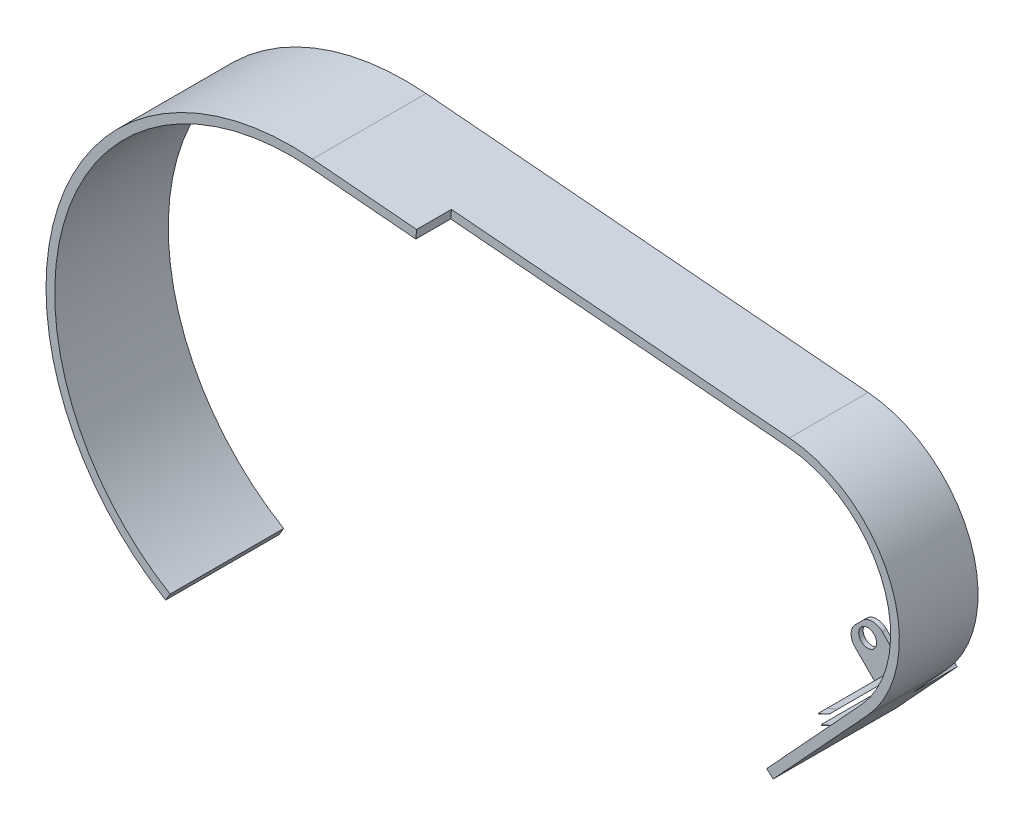
from build123d import *

# Parameters (mm, degrees)
BOSS_EXTRUDE1_DEPTH   = 25.4
BOSS_EXTRUDE1_2_DEPTH = 25.4
SKETCH2_R             = 7.0739
SKETCH2_R_2           = 3.2639
BOSS_EXTRUDE2_DEPTH   = 3.175
BOSS_EXTRUDE3_DEPTH   = 3.302
BOSS_EXTRUDE4_DEPTH   = 12.7
BOSS_EXTRUDE5_DEPTH   = 16.1925
SKETCH6_R             = 3.2639
BOSS_EXTRUDE6_DEPTH   = 1.5875


with BuildPart() as part:
    # Sketch1 → Boss-Extrude1 (new body)
    with BuildSketch(Plane.XY):
        with BuildLine():
            ThreePointArc((70.001721328, 21.116929737), (32.109818913, 121.760822938), (121.667937999, 181.295122405))
            Line((121.667937999, 181.295122405), (282.867264941, 167.491822308))
            ThreePointArc((282.867264941, 167.491822308), (317.285019746, 141.708326855), (309.281467912, 99.455354869))
            Line((309.281467912, 99.455354869), (298.182872237, 87.415180491))
            ThreePointArc((298.182872237, 87.415180491), (296.481974793, 86.652009193), (294.750152503, 85.961883046))
            Line((294.750152503, 85.961883046), (294.839214659, 85.723778364))
            Line((294.839214659, 85.723778364), (298.161838441, 87.392362238))
            Line((298.161838441, 87.392362238), (274.850661498, 62.103519979))
            Line((274.850661498, 62.103519979), (277.185151179, 59.951594578))
            Line((277.185151179, 59.951594578), (311.615957593, 97.303429468))
            ThreePointArc((311.615957593, 97.303429468), (320.244786914, 142.85741489), (283.138145015, 170.655245926))
            Line((283.138145015, 170.655245926), (121.938818073, 184.458546023))
            ThreePointArc((121.938818073, 184.458546023), (29.088121079, 122.735485546), (68.373108141, 18.391449213))
            Line((68.373108141, 18.391449213), (70.001721328, 21.116929737))
        make_face()
    extrude(amount=BOSS_EXTRUDE1_DEPTH)

    # Sketch2 → Boss-Extrude2 (add)
    # profile 1 of 2: a face of its own
    with BuildSketch(Plane(origin=(0, 0, 0), x_dir=(-1, 0, 0), z_dir=(0, 0, -1))):
        with BuildLine():
            ThreePointArc((-36.587701927, 50.782990283), (-44.384911147, 39.317928918), (-53.858754358, 29.194174745))
            Line((-53.858754358, 29.194174745), (-22.316186857, 12.775282108))
            ThreePointArc((-22.316186857, 12.775282108), (-23.932636358, 13.931413925), (-25.163710326, 15.491544259))
            ThreePointArc((-25.163710326, 15.491544259), (-23.930769686, 24.17036605), (-15.202863294, 24.986295173))
            ThreePointArc((-15.202863294, 24.986295173), (-14.373460165, 24.357545231), (-13.645291854, 23.613900861))
            Line((-13.645291854, 23.613900861), (-36.587701927, 50.782990283))
        make_face()
    # profile 2 of 2: a face of its own
    with BuildSketch(Plane(origin=(0, 0, 0), x_dir=(-1, 0, 0), z_dir=(0, 0, -1))):
        with Locations((-19.05, 19.05)):
            Circle(SKETCH2_R)
        with Locations((-19.05, 19.05)):
            Circle(SKETCH2_R_2, mode=Mode.SUBTRACT)
    extrude(amount=-BOSS_EXTRUDE2_DEPTH)

    # Sketch3 → Boss-Extrude3 (add)
    with BuildSketch(Plane.XY.offset(25.4)):
        with BuildLine():
            Line((68.373108141, 18.391449213), (70.001721328, 21.116929737))
            ThreePointArc((70.001721328, 21.116929737), (32.109818913, 121.760822938), (121.667937999, 181.295122405))
            Line((121.667937999, 181.295122405), (282.867264941, 167.491822308))
            ThreePointArc((282.867264941, 167.491822308), (317.285019746, 141.708326855), (309.281467912, 99.455354869))
            Line((309.281467912, 99.455354869), (298.182872237, 87.415180491))
            ThreePointArc((298.182872237, 87.415180491), (296.481974793, 86.652009193), (294.750152503, 85.961883046))
            Line((294.750152503, 85.961883046), (294.839214659, 85.723778364))
            Line((294.839214659, 85.723778364), (298.161838441, 87.392362238))
            Line((298.161838441, 87.392362238), (274.850661498, 62.103519979))
            Line((274.850661498, 62.103519979), (277.185151179, 59.951594578))
            Line((277.185151179, 59.951594578), (311.615957593, 97.303429468))
            ThreePointArc((311.615957593, 97.303429468), (320.244786914, 142.85741489), (283.138145015, 170.655245926))
            Line((283.138145015, 170.655245926), (121.938818073, 184.458546023))
            ThreePointArc((121.938818073, 184.458546023), (29.088121079, 122.735485546), (68.373108141, 18.391449213))
        make_face()
        with BuildLine():
            Line((293.637822612, 88.935659637), (293.720430988, 88.714808918))
            Line((293.720430988, 88.714808918), (297.638321365, 90.682328905))
            ThreePointArc((297.638321365, 90.682328905), (295.661540372, 89.755243259), (293.637822612, 88.935659637))
        make_face()
    extrude(amount=BOSS_EXTRUDE3_DEPTH)


with BuildPart() as body_2:
    # Sketch1 → Boss-Extrude1 2 (new body)
    with BuildSketch(Plane.XY):
        with BuildLine():
            ThreePointArc((297.638321365, 90.682328905), (295.661540372, 89.755243259), (293.637822612, 88.935659637))
            Line((293.637822612, 88.935659637), (293.720430988, 88.714808918))
            Line((293.720430988, 88.714808918), (297.638321365, 90.682328905))
        make_face()
    extrude(amount=BOSS_EXTRUDE1_2_DEPTH)


with BuildPart() as boss_extrude3_piece_1:
    # of the separate pieces the step leaves, piece 1, a body of its own (boss_extrude3_pieces)
    add(part.part.solids().sort_by_distance((70.001721328, 21.116929737, 28.702))[0])

    # Sketch4 → Boss-Extrude4 (add)
    with BuildSketch(Plane.XY.offset(28.702)):
        with BuildLine():
            Line((121.667937999, 181.295122405), (159.629021413, 178.044561523))
            Line((159.629021413, 178.044561523), (159.899901487, 181.207985141))
            Line((159.899901487, 181.207985141), (121.938818073, 184.458546023))
            ThreePointArc((121.938818073, 184.458546023), (29.088121079, 122.735485546), (68.373108141, 18.391449213))
            Line((68.373108141, 18.391449213), (70.001721328, 21.116929737))
            ThreePointArc((70.001721328, 21.116929737), (32.109818913, 121.760822938), (121.667937999, 181.295122405))
        make_face()
    extrude(amount=BOSS_EXTRUDE4_DEPTH)

    # Sketch5 → Boss-Extrude5 (add)
    with BuildSketch(Plane(origin=(0, 0, 0), x_dir=(-1, 0, 0), z_dir=(0, 0, -1))):
        Polygon((-277.185151179, 59.951594578), (-274.850661498, 62.103519979), (-297.070096233, 86.207999194), (-299.404585914, 84.056073793), align=None)
    extrude(amount=BOSS_EXTRUDE5_DEPTH)

    # Sketch6 → Boss-Extrude6 (add)
    with BuildSketch(Plane(origin=(0, 0, -16.1925), x_dir=(-1, 0, 0), z_dir=(0, 0, -1))):
        with BuildLine():
            Line((-274.850661498, 62.103519979), (-263.801215322, 73.152966154))
            ThreePointArc((-263.801215322, 73.152966154), (-262.313317771, 76.745068603), (-263.801215322, 80.337171051))
            Line((-263.801215322, 80.337171051), (-266.495292159, 83.031247888))
            ThreePointArc((-266.495292159, 83.031247888), (-270.087394607, 84.519145439), (-273.679497055, 83.031247888))
            Line((-273.679497055, 83.031247888), (-284.326969415, 72.383775528))
            Line((-284.326969415, 72.383775528), (-274.850661498, 62.103519979))
        make_face()
        with Locations((-268.354205176, 78.478258034)):
            Circle(SKETCH6_R, mode=Mode.SUBTRACT)
    extrude(amount=-BOSS_EXTRUDE6_DEPTH)


with BuildPart() as boss_extrude3_piece_2:
    # of the separate pieces the step leaves, piece 2, a body of its own (boss_extrude3_pieces)
    add(part.part.solids().sort_by_distance((293.637822612, 88.935659637, 25.4))[0])


solid = Compound([body_2.part, boss_extrude3_piece_1.part, boss_extrude3_piece_2.part])
